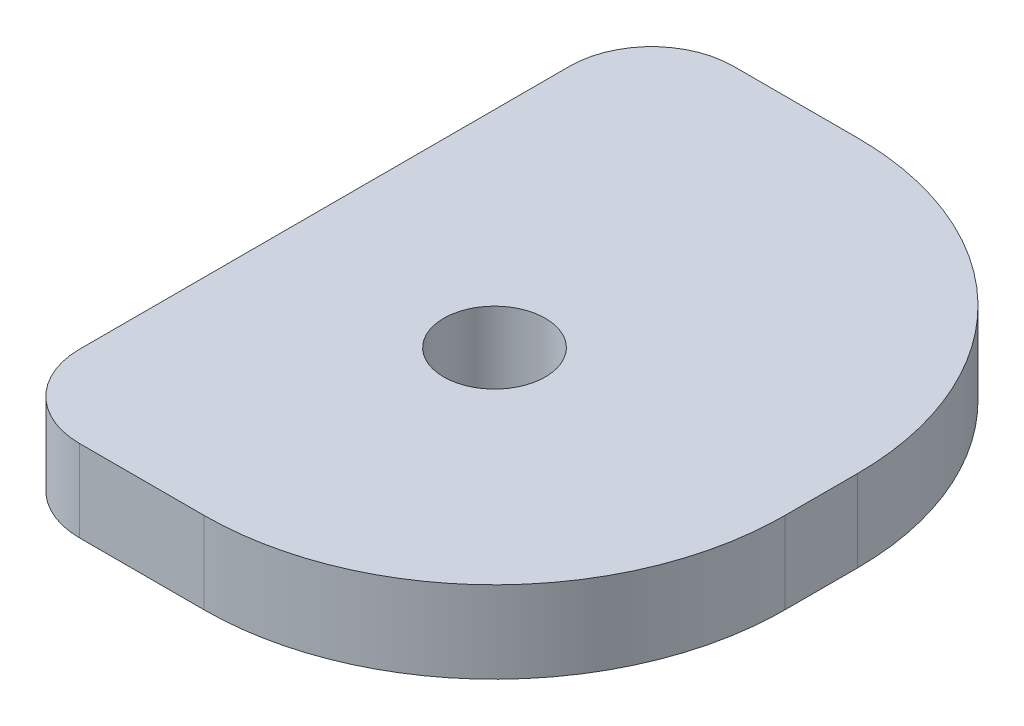
from build123d import *

# Parameters (mm, degrees)
SKETCH1_W           = 50.8
SKETCH1_H           = 22.86
BOSS_EXTRUDE1_DEPTH = 3.175
FILLET1_R           = 10.16
SKETCH3_R           = 1.778
CUT_EXTRUDE1_DEPTH  = 29.033649869
FILLET3_R           = 10.16
SCALE1_SCALE_X      = 1.11
SCALE1_SCALE_Y      = 1
SCALE1_SCALE_Z      = 1.11
SKETCH4_W           = 37.109400012
SKETCH4_H           = 25.3746
CUT_EXTRUDE2_DEPTH  = 32.091568995
FILLET4_R           = 3.175


with BuildPart() as part:
    # Sketch1 → Boss-Extrude1 (new body)
    with BuildSketch(Plane(origin=(0, 0, 0), x_dir=(1, 0, 0), z_dir=(0, 1, 0))):
        Rectangle(SKETCH1_W, SKETCH1_H)
    extrude(amount=BOSS_EXTRUDE1_DEPTH)

    # Fillet1
    fillet1_edges = [part.edges().sort_by_distance(p)[0] for p in [
        (25.4, 1.5875, 11.43),
        (-25.4, 1.5875, 11.43),
    ]]
    fillet(fillet1_edges, radius=FILLET1_R)

    # Sketch3 → Cut-Extrude1 (cut, through all)
    with BuildSketch(Plane(origin=(0, 3.175, 0), x_dir=(1, 0, 0), z_dir=(0, 1, 0))):
        with Locations(Location((15.24, -1.27, 0), (0, 0, 270))):
            Circle(SKETCH3_R)
        with Locations(Location((-3.81, -1.27, 0), (0, 0, 270))):
            Circle(SKETCH3_R)
    extrude(amount=-CUT_EXTRUDE1_DEPTH, mode=Mode.SUBTRACT)

    # Fillet3
    fillet3_edges = [part.edges().sort_by_distance(p)[0] for p in [
        (-25.4, 1.5875, -11.43),
        (25.4, 1.5875, -11.43),
    ]]
    fillet(fillet3_edges, radius=FILLET3_R)


with BuildPart() as part_1:
    # Scale1: scaled about (-0.107821996, 1.5875, -0.023960443)
    add(part.part.scale((SCALE1_SCALE_X, SCALE1_SCALE_Y, SCALE1_SCALE_Z), about=(-0.107821996, 1.5875, -0.023960443)))

    # Sketch4 → Cut-Extrude2 (cut, through all)
    with BuildSketch(Plane(origin=(0, 3.175, 0), x_dir=(1, 0, 0), z_dir=(0, 1, 0))):
        with Locations((-9.627439574, -0.002635649)):
            Rectangle(SKETCH4_W, SKETCH4_H)
    extrude(amount=-CUT_EXTRUDE2_DEPTH, mode=Mode.SUBTRACT)

    # Fillet4
    fillet4_edges = [part_1.edges().sort_by_distance(p)[0] for p in [
        (8.927260432, 1.5875, 12.689935649),
        (8.927260432, 1.5875, -12.684664351),
    ]]
    fillet(fillet4_edges, radius=FILLET4_R)


solid = part_1.part
